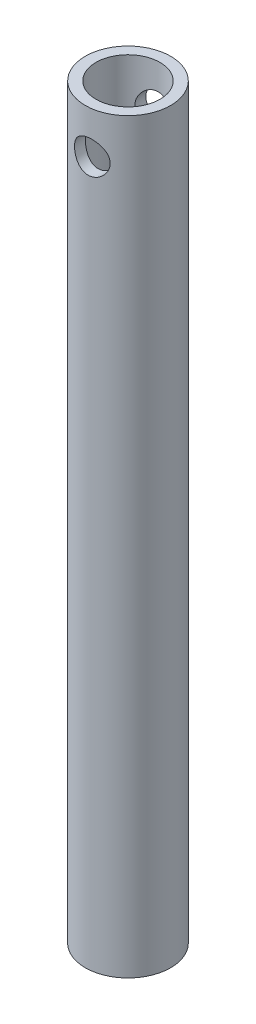
from build123d import *

# Parameters (mm, degrees)
SKETCH_1_R               = 4
SKETCH_1_R_2             = 3
EXTRUDE_1_DEPTH          = 70
CUT_EXTRUDE_1_DEPTH      = 71.312735176
CUT_EXTRUDE_1_DEPTH_BACK = 71.312735176
SKETCH_2_R               = 1.536255129


with BuildPart() as part:
    # 草图1 → 凸台-拉伸1 (new body)
    with BuildSketch(Plane(origin=(0, 0, 0), x_dir=(1, 0, 0), z_dir=(0, 1, 0))):
        with Locations(Location((0, 0, 0), (0, 0, 270))):
            Circle(SKETCH_1_R)
        with Locations(Location((0, 0, 0), (0, 0, 270))):
            Circle(SKETCH_1_R_2, mode=Mode.SUBTRACT)
    extrude(amount=EXTRUDE_1_DEPTH)

    # 草图2 → 切除-拉伸1 (cut, two sides: drawn at the far end of the back side and taken through both)
    with BuildSketch(Plane(origin=(0.110157831, 0, 1.194933158), x_dir=(0.9957776317458883, 0, -0.09179819232724673), z_dir=(0.09179819232724672, 0, 0.9957776317458882)).offset(-CUT_EXTRUDE_1_DEPTH_BACK)):
        with Locations((0, 66)):
            Circle(SKETCH_2_R)
    extrude(amount=CUT_EXTRUDE_1_DEPTH + CUT_EXTRUDE_1_DEPTH_BACK, mode=Mode.SUBTRACT)


solid = part.part
